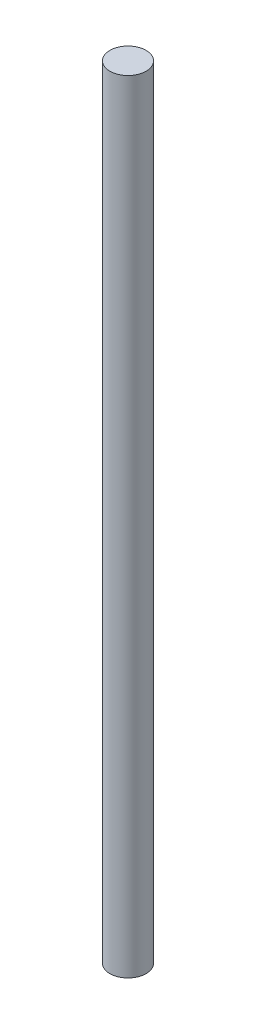
from build123d import *

# Parameters (mm, degrees)
SKETCH_1_R      = 1.75
EXTRUDE_1_DEPTH = 75.6


with BuildPart() as part:
    # 草图1 → 凸台-拉伸1 (new body)
    with BuildSketch(Plane(origin=(0, 0, 0), x_dir=(1, 0, 0), z_dir=(0, 1, 0))):
        with Locations(Location((0, 0, 0), (0, 0, 270))):
            Circle(SKETCH_1_R)
    extrude(amount=EXTRUDE_1_DEPTH)


solid = part.part
